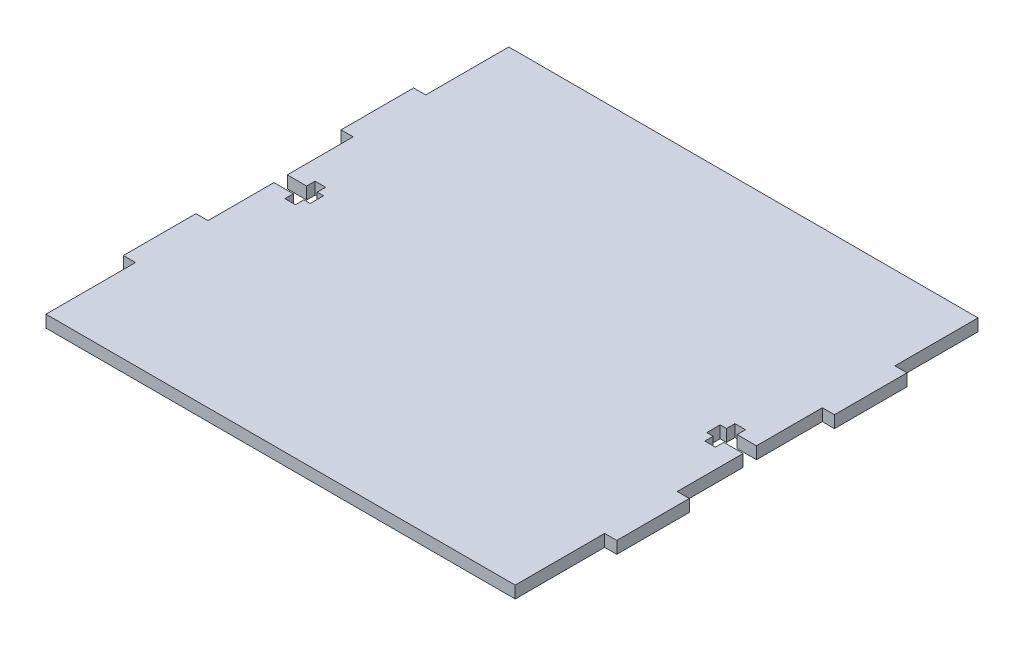
from build123d import *

# Parameters (mm, degrees)
BOSS_EXTRUDE1_DEPTH = 3.175


with BuildPart() as part:
    # Sketch1 → Boss-Extrude1 (new body)
    with BuildSketch(Plane(origin=(0, 0, 0), x_dir=(1, 0, 0), z_dir=(0, 1, 0))):
        Polygon((0, 99.695), (0, 121.51233), (123.19, 121.51233), (123.19, 99.695), (126.365, 99.695), (126.365, 80.645), (123.19, 80.645), (123.19, 63.3476), (118.11, 63.3476), (118.11, 65.56375), (115.331875, 65.56375), (115.331875, 63.3476), (113.665, 63.3476), (113.665, 59.8424), (115.331875, 59.8424), (115.331875, 57.62625), (118.11, 57.62625), (118.11, 59.8424), (123.19, 59.8424), (123.19, 42.545), (126.365, 42.545), (126.365, 23.495), (123.19, 23.495), (123.19, 0), (0, 0), (0, 23.495), (-3.175, 23.495), (-3.175, 42.545), (0, 42.545), (0, 59.8424), (5.08, 59.8424), (5.08, 57.62625), (7.858125, 57.62625), (7.858125, 59.8424), (9.525, 59.8424), (9.525, 63.3476), (7.858125, 63.3476), (7.858125, 65.56375), (5.08, 65.56375), (5.08, 63.3476), (0, 63.3476), (0, 80.645), (-3.175, 80.645), (-3.175, 99.695), align=None)
    extrude(amount=BOSS_EXTRUDE1_DEPTH)


solid = part.part
